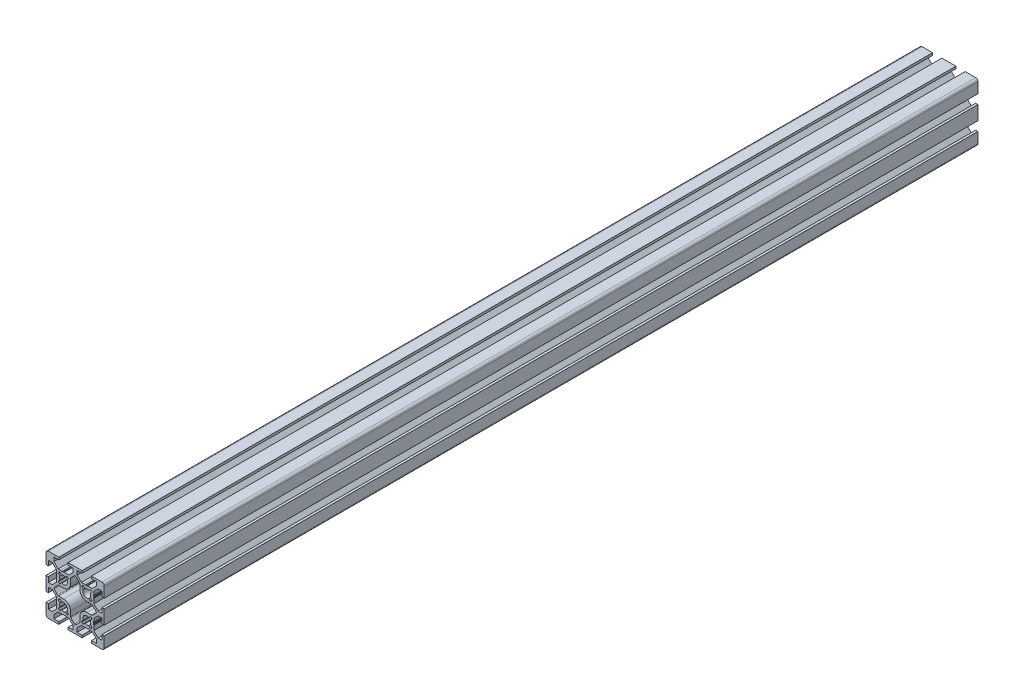
from build123d import *

# Parameters (mm, degrees)
BOSS_EXTRUDE1_DEPTH = 750
CUT_EXTRUDE1_DEPTH  = 751.832870884
CUT_EXTRUDE2_DEPTH  = 751.832870884
CUT_EXTRUDE3_DEPTH  = 751.832870884
CUT_EXTRUDE4_DEPTH  = 751.832870884


with BuildPart() as part:
    # Sketch1 → Boss-Extrude1 (new body)
    with BuildSketch(Plane.XY):
        with BuildLine():
            Line((-25, 23), (-25, 14))
            Line((-25, 14), (-23, 14))
            Line((-23, 14), (-23, 18.25))
            Line((-23, 18.25), (-19.664213562, 18.25))
            Line((-19.664213562, 18.25), (-16, 14.585786438))
            Line((-16, 14.585786438), (-16, 10.653589838))
            ThreePointArc((-16, 10.653589838), (-15.982962913, 10.524180316), (-15.933012702, 10.403589838))
            Line((-15.933012702, 10.403589838), (-15.7, 10))
            Line((-15.7, 10), (-15.933012702, 9.596410162))
            ThreePointArc((-15.933012702, 9.596410162), (-16, 9.346410162), (-15.933012702, 9.096410162))
            Line((-15.933012702, 9.096410162), (-15.750976592, 8.781114371))
            Line((-15.750976592, 8.781114371), (-16, 7.5))
            Line((-16, 7.5), (-16, 5.414213562))
            Line((-16, 5.414213562), (-19.664213562, 1.75))
            Line((-19.664213562, 1.75), (-23, 1.75))
            Line((-23, 1.75), (-23, 6))
            Line((-23, 6), (-25, 6))
            Line((-25, 6), (-25, -6))
            Line((-25, -6), (-23, -6))
            Line((-23, -6), (-23, -1.75))
            Line((-23, -1.75), (-19.664213562, -1.75))
            Line((-19.664213562, -1.75), (-16, -5.414213562))
            Line((-16, -5.414213562), (-16, -9.346410162))
            ThreePointArc((-16, -9.346410162), (-15.982962913, -9.475819684), (-15.933012702, -9.596410162))
            Line((-15.933012702, -9.596410162), (-15.7, -10))
            Line((-15.7, -10), (-15.933012702, -10.403589838))
            ThreePointArc((-15.933012702, -10.403589838), (-16, -10.653589838), (-15.933012702, -10.903589838))
            Line((-15.933012702, -10.903589838), (-15.750976592, -11.218885629))
            Line((-15.750976592, -11.218885629), (-16, -12.5))
            Line((-16, -12.5), (-16, -14.585786438))
            Line((-16, -14.585786438), (-19.664213562, -18.25))
            Line((-19.664213562, -18.25), (-23, -18.25))
            Line((-23, -18.25), (-23, -14))
            Line((-23, -14), (-25, -14))
            Line((-25, -14), (-25, -23))
            ThreePointArc((-25, -23), (-24.414213562, -24.414213562), (-23, -25))
            Line((-23, -25), (-14, -25))
            Line((-14, -25), (-14, -23))
            Line((-14, -23), (-18.25, -23))
            Line((-18.25, -23), (-18.25, -19.664213562))
            Line((-18.25, -19.664213562), (-14.585786438, -16))
            Line((-14.585786438, -16), (-10.653589838, -16))
            ThreePointArc((-10.653589838, -16), (-10.524180316, -15.982962913), (-10.403589838, -15.933012702))
            Line((-10.403589838, -15.933012702), (-10, -15.7))
            Line((-10, -15.7), (-9.596410162, -15.933012702))
            ThreePointArc((-9.596410162, -15.933012702), (-9.346410162, -16), (-9.096410162, -15.933012702))
            Line((-9.096410162, -15.933012702), (-8.781114371, -15.750976592))
            Line((-8.781114371, -15.750976592), (-7.5, -16))
            Line((-7.5, -16), (-5.414213562, -16))
            Line((-5.414213562, -16), (-1.75, -19.664213562))
            Line((-1.75, -19.664213562), (-1.75, -23))
            Line((-1.75, -23), (-6, -23))
            Line((-6, -23), (-6, -25))
            Line((-6, -25), (6, -25))
            Line((6, -25), (6, -23))
            Line((6, -23), (1.75, -23))
            Line((1.75, -23), (1.75, -19.664213562))
            Line((1.75, -19.664213562), (5.414213562, -16))
            Line((5.414213562, -16), (9.346410162, -16))
            ThreePointArc((9.346410162, -16), (9.475819684, -15.982962913), (9.596410162, -15.933012702))
            Line((9.596410162, -15.933012702), (10, -15.7))
            Line((10, -15.7), (10.403589838, -15.933012702))
            ThreePointArc((10.403589838, -15.933012702), (10.653589838, -16), (10.903589838, -15.933012702))
            Line((10.903589838, -15.933012702), (11.218885629, -15.750976592))
            Line((11.218885629, -15.750976592), (12.5, -16))
            Line((12.5, -16), (14.585786438, -16))
            Line((14.585786438, -16), (18.25, -19.664213562))
            Line((18.25, -19.664213562), (18.25, -23))
            Line((18.25, -23), (14, -23))
            Line((14, -23), (14, -25))
            Line((14, -25), (23, -25))
            ThreePointArc((23, -25), (24.414213562, -24.414213562), (25, -23))
            Line((25, -23), (25, -14))
            Line((25, -14), (23, -14))
            Line((23, -14), (23, -18.25))
            Line((23, -18.25), (19.664213562, -18.25))
            Line((19.664213562, -18.25), (16, -14.585786438))
            Line((16, -14.585786438), (16, -10.653589838))
            ThreePointArc((16, -10.653589838), (15.982962913, -10.524180316), (15.933012702, -10.403589838))
            Line((15.933012702, -10.403589838), (15.7, -10))
            Line((15.7, -10), (15.933012702, -9.596410162))
            ThreePointArc((15.933012702, -9.596410162), (16, -9.346410162), (15.933012702, -9.096410162))
            Line((15.933012702, -9.096410162), (15.750976592, -8.781114371))
            Line((15.750976592, -8.781114371), (16, -7.5))
            Line((16, -7.5), (16, -5.414213562))
            Line((16, -5.414213562), (19.664213562, -1.75))
            Line((19.664213562, -1.75), (23, -1.75))
            Line((23, -1.75), (23, -6))
            Line((23, -6), (25, -6))
            Line((25, -6), (25, 6))
            Line((25, 6), (23, 6))
            Line((23, 6), (23, 1.75))
            Line((23, 1.75), (19.664213562, 1.75))
            Line((19.664213562, 1.75), (16, 5.414213562))
            Line((16, 5.414213562), (16, 9.346410162))
            ThreePointArc((16, 9.346410162), (15.982962913, 9.475819684), (15.933012702, 9.596410162))
            Line((15.933012702, 9.596410162), (15.7, 10))
            Line((15.7, 10), (15.933012702, 10.403589838))
            ThreePointArc((15.933012702, 10.403589838), (16, 10.653589838), (15.933012702, 10.903589838))
            Line((15.933012702, 10.903589838), (15.750976592, 11.218885629))
            Line((15.750976592, 11.218885629), (16, 12.5))
            Line((16, 12.5), (16, 14.585786438))
            Line((16, 14.585786438), (19.664213562, 18.25))
            Line((19.664213562, 18.25), (23, 18.25))
            Line((23, 18.25), (23, 14))
            Line((23, 14), (25, 14))
            Line((25, 14), (25, 23))
            ThreePointArc((25, 23), (24.414213562, 24.414213562), (23, 25))
            Line((23, 25), (14, 25))
            Line((14, 25), (14, 23))
            Line((14, 23), (18.25, 23))
            Line((18.25, 23), (18.25, 19.664213562))
            Line((18.25, 19.664213562), (14.585786438, 16))
            Line((14.585786438, 16), (10.653589838, 16))
            ThreePointArc((10.653589838, 16), (10.524180316, 15.982962913), (10.403589838, 15.933012702))
            Line((10.403589838, 15.933012702), (10, 15.7))
            Line((10, 15.7), (9.596410162, 15.933012702))
            ThreePointArc((9.596410162, 15.933012702), (9.346410162, 16), (9.096410162, 15.933012702))
            Line((9.096410162, 15.933012702), (8.781114371, 15.750976592))
            Line((8.781114371, 15.750976592), (7.5, 16))
            Line((7.5, 16), (5.414213562, 16))
            Line((5.414213562, 16), (1.75, 19.664213562))
            Line((1.75, 19.664213562), (1.75, 23))
            Line((1.75, 23), (6, 23))
            Line((6, 23), (6, 25))
            Line((6, 25), (-6, 25))
            Line((-6, 25), (-6, 23))
            Line((-6, 23), (-1.75, 23))
            Line((-1.75, 23), (-1.75, 19.664213562))
            Line((-1.75, 19.664213562), (-5.414213562, 16))
            Line((-5.414213562, 16), (-9.346410162, 16))
            ThreePointArc((-9.346410162, 16), (-9.475819684, 15.982962913), (-9.596410162, 15.933012702))
            Line((-9.596410162, 15.933012702), (-10, 15.7))
            Line((-10, 15.7), (-10.403589838, 15.933012702))
            ThreePointArc((-10.403589838, 15.933012702), (-10.653589838, 16), (-10.903589838, 15.933012702))
            Line((-10.903589838, 15.933012702), (-11.218885629, 15.750976592))
            Line((-11.218885629, 15.750976592), (-12.5, 16))
            Line((-12.5, 16), (-14.585786438, 16))
            Line((-14.585786438, 16), (-18.25, 19.664213562))
            Line((-18.25, 19.664213562), (-18.25, 23))
            Line((-18.25, 23), (-14, 23))
            Line((-14, 23), (-14, 25))
            Line((-14, 25), (-23, 25))
            ThreePointArc((-23, 25), (-24.414213562, 24.414213562), (-25, 23))
        make_face()
        with BuildLine():
            Line((-17.878679656, -0.707106781), (-14.878679656, -3.707106781))
            ThreePointArc((-14.878679656, -3.707106781), (-14.554256308, -3.923879533), (-14.171572875, -4))
            Line((-14.171572875, -4), (-10, -4))
            ThreePointArc((-10, -4), (-5.757359313, -5.757359313), (-4, -10))
            Line((-4, -10), (-4, -14.171572875))
            ThreePointArc((-4, -14.171572875), (-3.923879533, -14.554256308), (-3.707106781, -14.878679656))
            Line((-3.707106781, -14.878679656), (-0.707106781, -17.878679656))
            ThreePointArc((-0.707106781, -17.878679656), (0, -18.171572875), (0.707106781, -17.878679656))
            Line((0.707106781, -17.878679656), (3.707106781, -14.878679656))
            ThreePointArc((3.707106781, -14.878679656), (3.923879533, -14.554256308), (4, -14.171572875))
            Line((4, -14.171572875), (4, -10))
            ThreePointArc((4, -10), (5.757359313, -5.757359313), (10, -4))
            Line((10, -4), (14.171572875, -4))
            ThreePointArc((14.171572875, -4), (14.554256308, -3.923879533), (14.878679656, -3.707106781))
            Line((14.878679656, -3.707106781), (17.878679656, -0.707106781))
            ThreePointArc((17.878679656, -0.707106781), (18.171572875, 0), (17.878679656, 0.707106781))
            Line((17.878679656, 0.707106781), (14.878679656, 3.707106781))
            ThreePointArc((14.878679656, 3.707106781), (14.554256308, 3.923879533), (14.171572875, 4))
            Line((14.171572875, 4), (10, 4))
            ThreePointArc((10, 4), (5.757359313, 5.757359313), (4, 10))
            Line((4, 10), (4, 14.171572875))
            ThreePointArc((4, 14.171572875), (3.923879533, 14.554256308), (3.707106781, 14.878679656))
            Line((3.707106781, 14.878679656), (0.707106781, 17.878679656))
            ThreePointArc((0.707106781, 17.878679656), (0, 18.171572875), (-0.707106781, 17.878679656))
            Line((-0.707106781, 17.878679656), (-3.707106781, 14.878679656))
            ThreePointArc((-3.707106781, 14.878679656), (-3.923879533, 14.554256308), (-4, 14.171572875))
            Line((-4, 14.171572875), (-4, 10))
            ThreePointArc((-4, 10), (-5.757359313, 5.757359313), (-10, 4))
            Line((-10, 4), (-14.171572875, 4))
            ThreePointArc((-14.171572875, 4), (-14.554256308, 3.923879533), (-14.878679656, 3.707106781))
            Line((-14.878679656, 3.707106781), (-17.878679656, 0.707106781))
            ThreePointArc((-17.878679656, 0.707106781), (-18.171572875, 0), (-17.878679656, -0.707106781))
        make_face(mode=Mode.SUBTRACT)
    extrude(amount=-BOSS_EXTRUDE1_DEPTH)

    # Sketch2 → Cut-Extrude1 (cut, through all)
    with BuildSketch(Plane.XY):
        with BuildLine():
            Line((-14.242640687, 12.828427125), (-13.205105981, 11.790892418))
            ThreePointArc((-13.205105981, 11.790892418), (-13.095045749, 11.583064884), (-13.120796199, 11.349307631))
            ThreePointArc((-13.120796199, 11.349307631), (-13.4, 10.000000021), (-13.120796216, 8.650692407))
            ThreePointArc((-13.120796216, 8.650692407), (-13.095045745, 8.416935137), (-13.205105981, 8.209107582))
            Line((-13.205105981, 8.209107582), (-14.242640687, 7.171572875))
            ThreePointArc((-14.242640687, 7.171572875), (-14.389087297, 6.818019485), (-14.242640687, 6.464466094))
            Line((-14.242640687, 6.464466094), (-13.535533906, 5.757359313))
            ThreePointArc((-13.535533906, 5.757359313), (-13.181980515, 5.610912703), (-12.828427125, 5.757359313))
            Line((-12.828427125, 5.757359313), (-11.790892418, 6.794894019))
            ThreePointArc((-11.790892418, 6.794894019), (-11.583064884, 6.904954251), (-11.349307631, 6.879203801))
            ThreePointArc((-11.349307631, 6.879203801), (-7.595836944, 7.595836944), (-6.879203801, 11.349307631))
            ThreePointArc((-6.879203801, 11.349307631), (-6.904954251, 11.583064884), (-6.794894019, 11.790892418))
            Line((-6.794894019, 11.790892418), (-5.757359313, 12.828427125))
            ThreePointArc((-5.757359313, 12.828427125), (-5.610912703, 13.181980515), (-5.757359313, 13.535533906))
            Line((-5.757359313, 13.535533906), (-6.464466094, 14.242640687))
            ThreePointArc((-6.464466094, 14.242640687), (-6.818019485, 14.389087297), (-7.171572875, 14.242640687))
            Line((-7.171572875, 14.242640687), (-8.209107582, 13.205105981))
            ThreePointArc((-8.209107582, 13.205105981), (-8.416935116, 13.095045749), (-8.650692369, 13.120796199))
            ThreePointArc((-8.650692369, 13.120796199), (-9.999999979, 13.4), (-11.349307593, 13.120796216))
            ThreePointArc((-11.349307593, 13.120796216), (-11.583064863, 13.095045745), (-11.790892418, 13.205105981))
            Line((-11.790892418, 13.205105981), (-12.828427125, 14.242640687))
            ThreePointArc((-12.828427125, 14.242640687), (-13.181980515, 14.389087297), (-13.535533906, 14.242640687))
            Line((-13.535533906, 14.242640687), (-14.242640687, 13.535533906))
            ThreePointArc((-14.242640687, 13.535533906), (-14.389087297, 13.181980515), (-14.242640687, 12.828427125))
        make_face()
    extrude(amount=-CUT_EXTRUDE1_DEPTH, mode=Mode.SUBTRACT)

    # Sketch3 → Cut-Extrude2 (cut, through all)
    with BuildSketch(Plane.XY):
        with BuildLine():
            Line((-12.828427125, -14.242640687), (-11.790892418, -13.205105981))
            ThreePointArc((-11.790892418, -13.205105981), (-11.583064884, -13.095045749), (-11.349307631, -13.120796199))
            ThreePointArc((-11.349307631, -13.120796199), (-10.000000021, -13.4), (-8.650692407, -13.120796216))
            ThreePointArc((-8.650692407, -13.120796216), (-8.416935137, -13.095045745), (-8.209107582, -13.205105981))
            Line((-8.209107582, -13.205105981), (-7.171572875, -14.242640687))
            ThreePointArc((-7.171572875, -14.242640687), (-6.818019485, -14.389087297), (-6.464466094, -14.242640687))
            Line((-6.464466094, -14.242640687), (-5.757359313, -13.535533906))
            ThreePointArc((-5.757359313, -13.535533906), (-5.610912703, -13.181980515), (-5.757359313, -12.828427125))
            Line((-5.757359313, -12.828427125), (-6.794894019, -11.790892418))
            ThreePointArc((-6.794894019, -11.790892418), (-6.904954251, -11.583064884), (-6.879203801, -11.349307631))
            ThreePointArc((-6.879203801, -11.349307631), (-7.595836944, -7.595836944), (-11.349307631, -6.879203801))
            ThreePointArc((-11.349307631, -6.879203801), (-11.583064884, -6.904954251), (-11.790892418, -6.794894019))
            Line((-11.790892418, -6.794894019), (-12.828427125, -5.757359313))
            ThreePointArc((-12.828427125, -5.757359313), (-13.181980515, -5.610912703), (-13.535533906, -5.757359313))
            Line((-13.535533906, -5.757359313), (-14.242640687, -6.464466094))
            ThreePointArc((-14.242640687, -6.464466094), (-14.389087297, -6.818019485), (-14.242640687, -7.171572875))
            Line((-14.242640687, -7.171572875), (-13.205105981, -8.209107582))
            ThreePointArc((-13.205105981, -8.209107582), (-13.095045749, -8.416935116), (-13.120796199, -8.650692369))
            ThreePointArc((-13.120796199, -8.650692369), (-13.4, -9.999999979), (-13.120796216, -11.349307593))
            ThreePointArc((-13.120796216, -11.349307593), (-13.095045745, -11.583064863), (-13.205105981, -11.790892418))
            Line((-13.205105981, -11.790892418), (-14.242640687, -12.828427125))
            ThreePointArc((-14.242640687, -12.828427125), (-14.389087297, -13.181980515), (-14.242640687, -13.535533906))
            Line((-14.242640687, -13.535533906), (-13.535533906, -14.242640687))
            ThreePointArc((-13.535533906, -14.242640687), (-13.181980515, -14.389087297), (-12.828427125, -14.242640687))
        make_face()
    extrude(amount=-CUT_EXTRUDE2_DEPTH, mode=Mode.SUBTRACT)

    # Sketch4 → Cut-Extrude3 (cut, through all)
    with BuildSketch(Plane.XY):
        with BuildLine():
            Line((14.242640687, -12.828427125), (13.205105981, -11.790892418))
            ThreePointArc((13.205105981, -11.790892418), (13.095045749, -11.583064884), (13.120796199, -11.349307631))
            ThreePointArc((13.120796199, -11.349307631), (13.4, -10.000000021), (13.120796216, -8.650692407))
            ThreePointArc((13.120796216, -8.650692407), (13.095045745, -8.416935137), (13.205105981, -8.209107582))
            Line((13.205105981, -8.209107582), (14.242640687, -7.171572875))
            ThreePointArc((14.242640687, -7.171572875), (14.389087297, -6.818019485), (14.242640687, -6.464466094))
            Line((14.242640687, -6.464466094), (13.535533906, -5.757359313))
            ThreePointArc((13.535533906, -5.757359313), (13.181980515, -5.610912703), (12.828427125, -5.757359313))
            Line((12.828427125, -5.757359313), (11.790892418, -6.794894019))
            ThreePointArc((11.790892418, -6.794894019), (11.583064884, -6.904954251), (11.349307631, -6.879203801))
            ThreePointArc((11.349307631, -6.879203801), (7.595836944, -7.595836944), (6.879203801, -11.349307631))
            ThreePointArc((6.879203801, -11.349307631), (6.904954251, -11.583064884), (6.794894019, -11.790892418))
            Line((6.794894019, -11.790892418), (5.757359313, -12.828427125))
            ThreePointArc((5.757359313, -12.828427125), (5.610912703, -13.181980515), (5.757359313, -13.535533906))
            Line((5.757359313, -13.535533906), (6.464466094, -14.242640687))
            ThreePointArc((6.464466094, -14.242640687), (6.818019485, -14.389087297), (7.171572875, -14.242640687))
            Line((7.171572875, -14.242640687), (8.209107582, -13.205105981))
            ThreePointArc((8.209107582, -13.205105981), (8.416935116, -13.095045749), (8.650692369, -13.120796199))
            ThreePointArc((8.650692369, -13.120796199), (9.999999979, -13.4), (11.349307593, -13.120796216))
            ThreePointArc((11.349307593, -13.120796216), (11.583064863, -13.095045745), (11.790892418, -13.205105981))
            Line((11.790892418, -13.205105981), (12.828427125, -14.242640687))
            ThreePointArc((12.828427125, -14.242640687), (13.181980515, -14.389087297), (13.535533906, -14.242640687))
            Line((13.535533906, -14.242640687), (14.242640687, -13.535533906))
            ThreePointArc((14.242640687, -13.535533906), (14.389087297, -13.181980515), (14.242640687, -12.828427125))
        make_face()
    extrude(amount=-CUT_EXTRUDE3_DEPTH, mode=Mode.SUBTRACT)

    # Sketch5 → Cut-Extrude4 (cut, through all)
    with BuildSketch(Plane.XY):
        with BuildLine():
            Line((12.828427125, 14.242640687), (11.790892418, 13.205105981))
            ThreePointArc((11.790892418, 13.205105981), (11.583064884, 13.095045749), (11.349307631, 13.120796199))
            ThreePointArc((11.349307631, 13.120796199), (10.000000021, 13.4), (8.650692407, 13.120796216))
            ThreePointArc((8.650692407, 13.120796216), (8.416935137, 13.095045745), (8.209107582, 13.205105981))
            Line((8.209107582, 13.205105981), (7.171572875, 14.242640687))
            ThreePointArc((7.171572875, 14.242640687), (6.818019485, 14.389087297), (6.464466094, 14.242640687))
            Line((6.464466094, 14.242640687), (5.757359313, 13.535533906))
            ThreePointArc((5.757359313, 13.535533906), (5.610912703, 13.181980515), (5.757359313, 12.828427125))
            Line((5.757359313, 12.828427125), (6.794894019, 11.790892418))
            ThreePointArc((6.794894019, 11.790892418), (6.904954251, 11.583064884), (6.879203801, 11.349307631))
            ThreePointArc((6.879203801, 11.349307631), (7.595836944, 7.595836944), (11.349307631, 6.879203801))
            ThreePointArc((11.349307631, 6.879203801), (11.583064884, 6.904954251), (11.790892418, 6.794894019))
            Line((11.790892418, 6.794894019), (12.828427125, 5.757359313))
            ThreePointArc((12.828427125, 5.757359313), (13.181980515, 5.610912703), (13.535533906, 5.757359313))
            Line((13.535533906, 5.757359313), (14.242640687, 6.464466094))
            ThreePointArc((14.242640687, 6.464466094), (14.389087297, 6.818019485), (14.242640687, 7.171572875))
            Line((14.242640687, 7.171572875), (13.205105981, 8.209107582))
            ThreePointArc((13.205105981, 8.209107582), (13.095045749, 8.416935116), (13.120796199, 8.650692369))
            ThreePointArc((13.120796199, 8.650692369), (13.4, 9.999999979), (13.120796216, 11.349307593))
            ThreePointArc((13.120796216, 11.349307593), (13.095045745, 11.583064863), (13.205105981, 11.790892418))
            Line((13.205105981, 11.790892418), (14.242640687, 12.828427125))
            ThreePointArc((14.242640687, 12.828427125), (14.389087297, 13.181980515), (14.242640687, 13.535533906))
            Line((14.242640687, 13.535533906), (13.535533906, 14.242640687))
            ThreePointArc((13.535533906, 14.242640687), (13.181980515, 14.389087297), (12.828427125, 14.242640687))
        make_face()
    extrude(amount=-CUT_EXTRUDE4_DEPTH, mode=Mode.SUBTRACT)


solid = part.part
